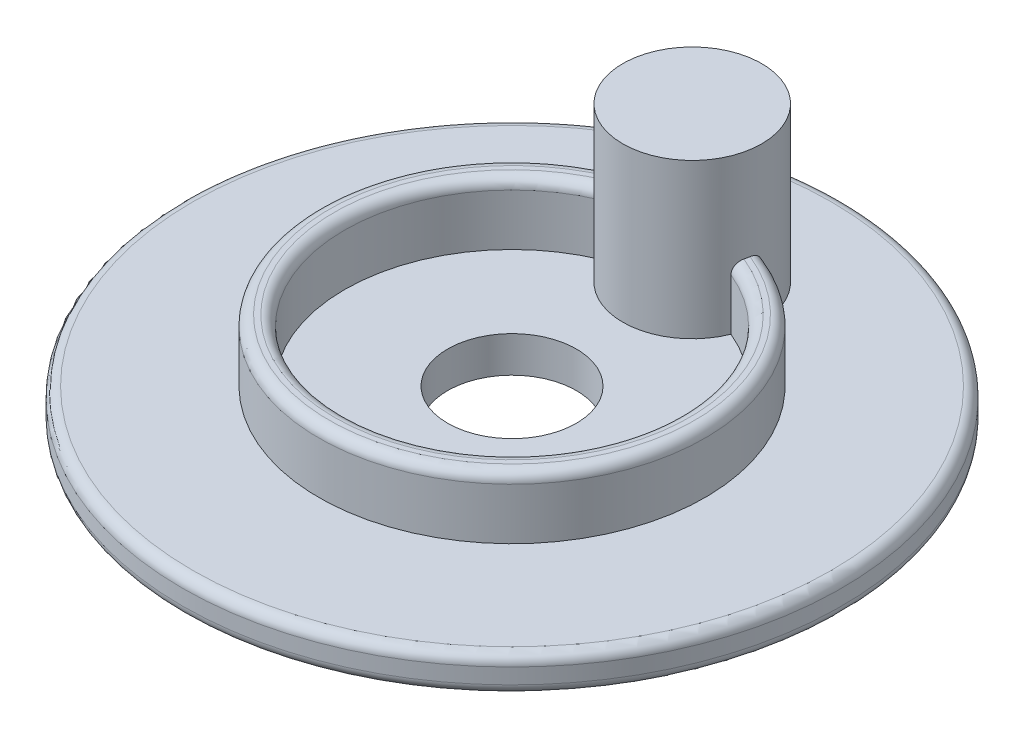
from build123d import *

# Parameters (mm, degrees)
SKETCH1_R           = 64
BOSS_EXTRUDE1_DEPTH = 7
SKETCH2_R           = 37.5
SKETCH2_R_2         = 32.5
BOSS_EXTRUDE2_DEPTH = 12
SKETCH3_R           = 12.5
CUT_EXTRUDE1_DEPTH  = 92.301697684
FILLET1_R           = 2
SKETCH4_R           = 13.5
BOSS_EXTRUDE3_DEPTH = 30


with BuildPart() as part:
    # Sketch1 → Boss-Extrude1 (new body)
    with BuildSketch(Plane(origin=(0, 0, 0), x_dir=(1, 0, 0), z_dir=(0, 1, 0))):
        with Locations(Location((0, 0, 0), (0, 0, 270))):
            Circle(SKETCH1_R)
    extrude(amount=BOSS_EXTRUDE1_DEPTH)

    # Sketch2 → Boss-Extrude2 (add)
    with BuildSketch(Plane(origin=(0, 7, 0), x_dir=(1, 0, 0), z_dir=(0, 1, 0))):
        with Locations(Location((0, 0, 0), (0, 0, 270))):
            Circle(SKETCH2_R)
        with Locations(Location((0, 0, 0), (0, 0, 270))):
            Circle(SKETCH2_R_2, mode=Mode.SUBTRACT)
    extrude(amount=BOSS_EXTRUDE2_DEPTH)

    # Sketch3 → Cut-Extrude1 (cut, through all)
    with BuildSketch(Plane(origin=(0, 7, 0), x_dir=(1, 0, 0), z_dir=(0, 1, 0))):
        with Locations(Location((0, 0, 0), (0, 0, 270))):
            Circle(SKETCH3_R)
    extrude(amount=-CUT_EXTRUDE1_DEPTH, mode=Mode.SUBTRACT)

    # Fillet1
    fillet1_edges = [part.edges().sort_by_distance(p)[0] for p in [
        (0, 0, -64),
        (0, 7, -64),
        (0, 19, -37.5),
        (0, 19, -32.5),
    ]]
    fillet(fillet1_edges, radius=FILLET1_R)

    # Sketch4 → Boss-Extrude3 (add)
    with BuildSketch(Plane(origin=(0, 7, 0), x_dir=(1, 0, 0), z_dir=(0, 1, 0))):
        with Locations(Location((0, 35, 0), (0, 0, 359.939369671))):
            Circle(SKETCH4_R)
    extrude(amount=BOSS_EXTRUDE3_DEPTH)


solid = part.part
